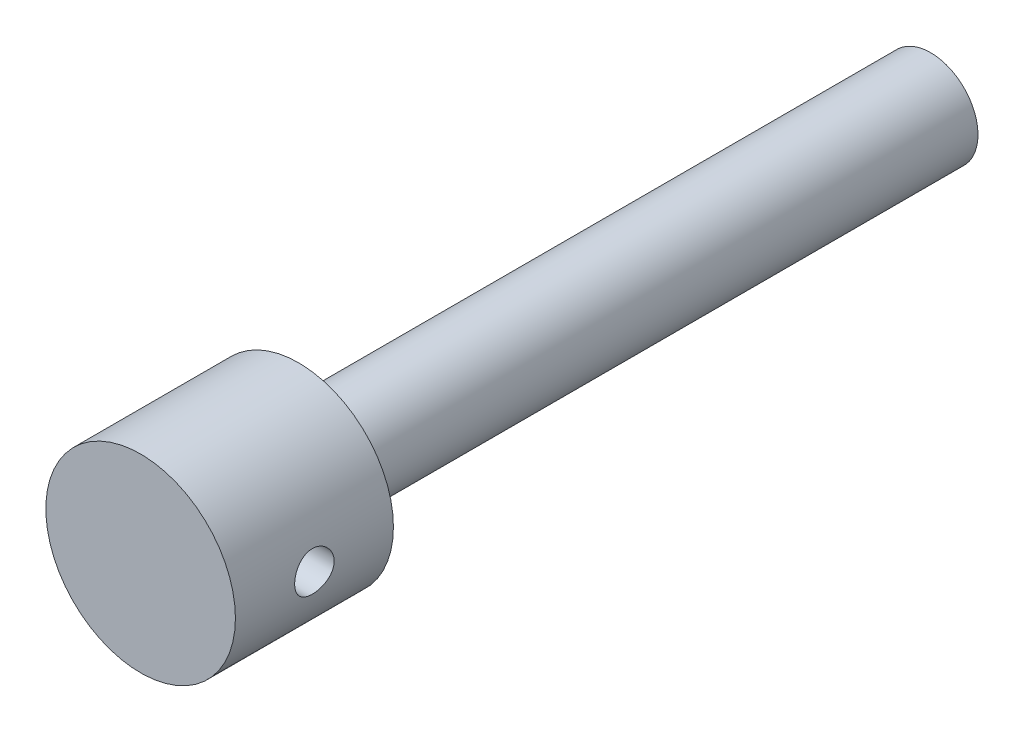
from build123d import *

# Parameters (mm, degrees)
SKETCH1_R           = 6
BOSS_EXTRUDE1_DEPTH = 80
SKETCH2_R           = 12
BOSS_EXTRUDE2_DEPTH = 20
SKETCH4_R           = 2.5
CUT_EXTRUDE2_DEPTH  = 104.537432844


with BuildPart() as part:
    # Sketch1 → Boss-Extrude1 (new body)
    with BuildSketch(Plane.XY):
        Circle(SKETCH1_R)
    extrude(amount=BOSS_EXTRUDE1_DEPTH)

    # Sketch2 → Boss-Extrude2 (add)
    with BuildSketch(Plane.XY.offset(80)):
        Circle(SKETCH2_R)
    extrude(amount=BOSS_EXTRUDE2_DEPTH)

    # Sketch4 → Cut-Extrude2 (cut, through all)
    with BuildSketch(Plane.ZY.offset(12)):
        with Locations((90, 0)):
            Circle(SKETCH4_R)
    extrude(amount=-CUT_EXTRUDE2_DEPTH, mode=Mode.SUBTRACT)


solid = part.part
